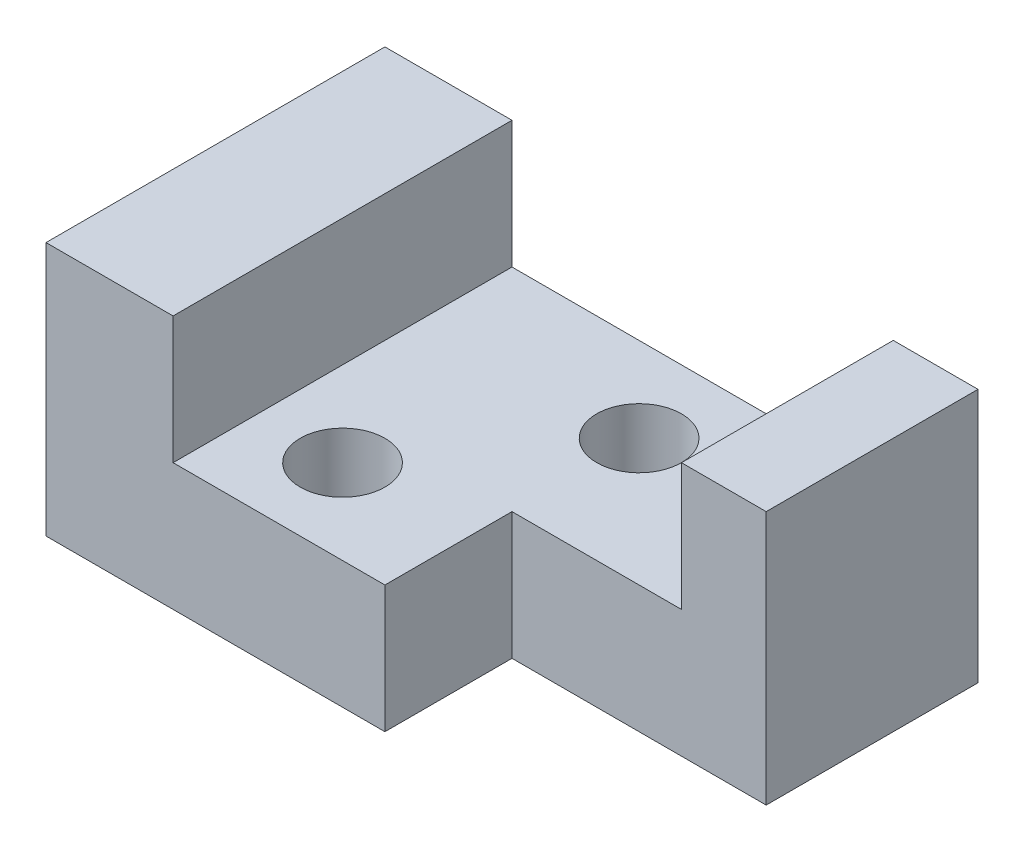
from build123d import *

# Parameters (mm, degrees)
BASE_FEATURE_DEPTH         = 25.4
SKETCH2_W                  = 38.1
SKETCH2_H                  = 19.05
ALTITUDUAL_CUT_DEPTH       = 67.067470248
F_1_2_0_5_DIAMETER_HOLES_D = 12.7


with BuildPart() as part:
    # Sketch1 → Base Feature (new, symmetric)
    with BuildSketch(Plane.XY):
        Polygon((-47.625, 0), (41.275, 0), (41.275, 38.1), (28.575, 38.1), (28.575, 19.05), (-28.575, 19.05), (-28.575, 38.1), (-47.625, 38.1), align=None)
    extrude(amount=BASE_FEATURE_DEPTH, both=True)

    # Sketch2 → Altitudual Cut (cut, through all)
    with BuildSketch(Plane.XZ):
        with Locations((22.225, 15.875)):
            Rectangle(SKETCH2_W, SKETCH2_H)
    extrude(amount=-ALTITUDUAL_CUT_DEPTH, mode=Mode.SUBTRACT)

    # 1/2 (0.5) Diameter Holes (through all)
    with Locations(Plane(origin=(0, 19.05, 0), x_dir=(1, 0, 0), z_dir=(0, 1, 0))):
        with Locations((-15.875, -12.7), (3.175, 12.7)):
            Hole(F_1_2_0_5_DIAMETER_HOLES_D / 2)


solid = part.part
